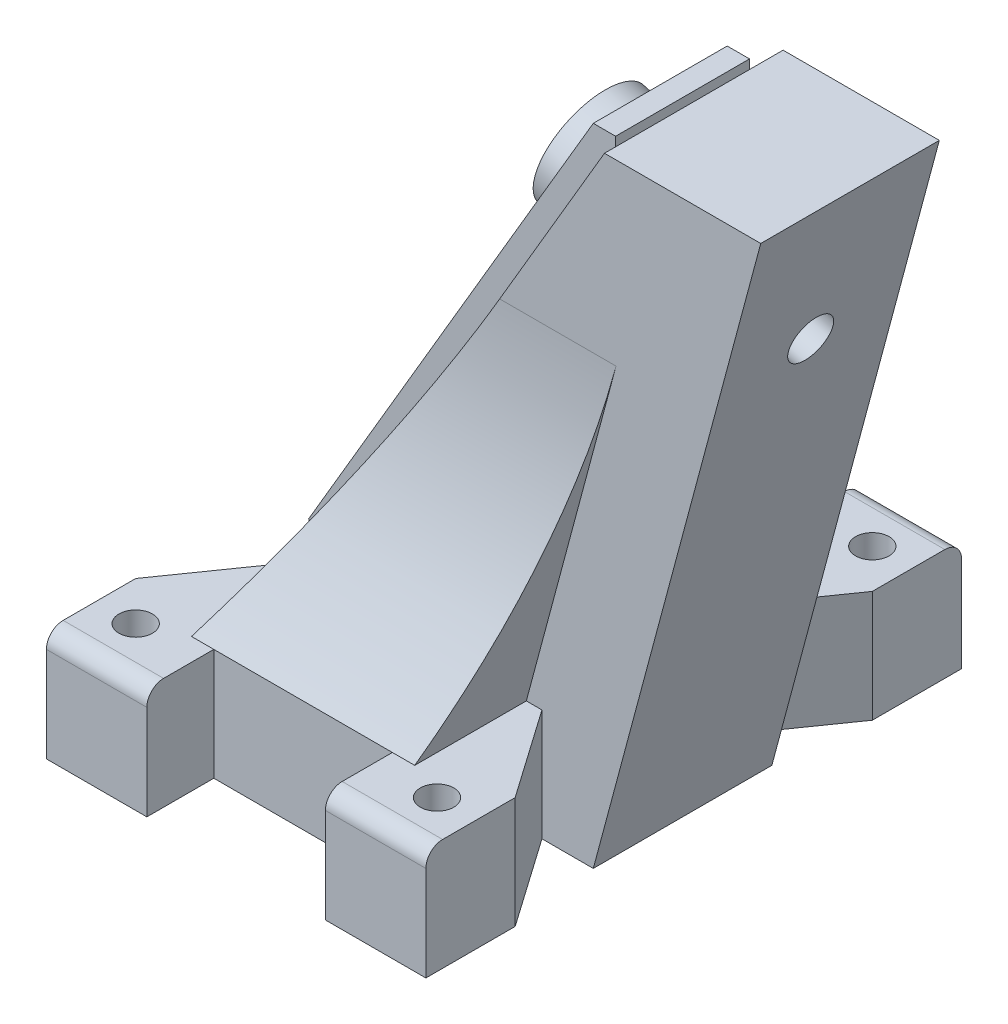
from build123d import *

# Parameters (mm, degrees)
BOSS_EXTRUDE1_DEPTH = 36
CUT_EXTRUDE1_REACH  = 77.774
SKETCH5_W           = 10
SKETCH5_H           = 10
CUT_EXTRUDE4_DEPTH  = 70.808427336
SKETCH6_W           = 10
SKETCH6_H           = 49.869122111
CUT_EXTRUDE5_DEPTH  = 8.383745
SKETCH7_R           = 1.5
BOSS_EXTRUDE2_DEPTH = 10
BOSS_EXTRUDE3_DEPTH = 6
SKETCH9_R           = 5
BOSS_EXTRUDE4_DEPTH = 20.4
CUT_EXTRUDE7_REACH  = 76.44
SKETCH12_R          = 2
FILLET1_R           = 1.5


with BuildPart() as part:
    # Sketch1 → Boss-Extrude1 (new body)
    with BuildSketch(Plane.XY):
        Polygon((0, 0), (-26, 0), (-26, 10), (1.005154776, 56), (15.005154776, 56), align=None)
    extrude(amount=BOSS_EXTRUDE1_DEPTH)

    # Sketch2 → Cut-Extrude1 (cut, up to next)
    with BuildSketch(Plane(origin=(-26, 3.422964937, 0), x_dir=(0, 0, -1), z_dir=(1, 0, 0)), mode=Mode.PRIVATE) as cut_extrude1_sk1:
        with BuildLine():
            Line((-26, 36.577035063), (-26, 52.577035063))
            Line((-26, 52.577035063), (-36, 52.577035063))
            Line((-36, 52.577035063), (-36, 6.577035063))
            ThreePointArc((-36, 6.577035063), (-28.565835097, 20.765646762), (-26, 36.577035063))
        make_face()
    cut_extrude1_tool1 = extrude(cut_extrude1_sk1.sketch, amount=CUT_EXTRUDE1_REACH, mode=Mode.PRIVATE) & part.part
    # Sketch2 → Cut-Extrude1 (cut, up to next)
    with BuildSketch(Plane(origin=(-26, 3.422964937, 0), x_dir=(0, 0, -1), z_dir=(1, 0, 0)), mode=Mode.PRIVATE) as cut_extrude1_sk2:
        with BuildLine():
            ThreePointArc((-10, 36.577035063), (-7.434164903, 20.765646762), (0, 6.577035063))
            Line((0, 6.577035063), (0, 52.577035063))
            Line((0, 52.577035063), (-10, 52.577035063))
            Line((-10, 52.577035063), (-10, 36.577035063))
        make_face()
    cut_extrude1_tool2 = extrude(cut_extrude1_sk2.sketch, amount=CUT_EXTRUDE1_REACH, mode=Mode.PRIVATE) & part.part
    # Sketch2 → Cut-Extrude1 (cut, up to next)
    with BuildSketch(Plane(origin=(-26, 3.422964937, 0), x_dir=(0, 0, -1), z_dir=(1, 0, 0)), mode=Mode.PRIVATE) as cut_extrude1_sk3:
        with BuildLine():
            ThreePointArc((-36, 6.577035063), (-28.565835097, 20.765646762), (-26, 36.577035063))
            Line((-26, 36.577035063), (-26, 52.577035063))
            Line((-26, 52.577035063), (-36, 52.577035063))
            Line((-36, 52.577035063), (-36, 6.577035063))
        make_face()
    cut_extrude1_tool3 = extrude(cut_extrude1_sk3.sketch, amount=CUT_EXTRUDE1_REACH, mode=Mode.PRIVATE) & part.part
    # Sketch2 → Cut-Extrude1 (cut, up to next)
    with BuildSketch(Plane(origin=(-26, 3.422964937, 0), x_dir=(0, 0, -1), z_dir=(1, 0, 0)), mode=Mode.PRIVATE) as cut_extrude1_sk4:
        with BuildLine():
            Line((0, 6.577035063), (0, 52.577035063))
            Line((0, 52.577035063), (-10, 52.577035063))
            Line((-10, 52.577035063), (-10, 36.577035063))
            ThreePointArc((-10, 36.577035063), (-7.434164903, 20.765646762), (0, 6.577035063))
        make_face()
    cut_extrude1_tool4 = extrude(cut_extrude1_sk4.sketch, amount=CUT_EXTRUDE1_REACH, mode=Mode.PRIVATE) & part.part
    add(cut_extrude1_tool1.solids().sort_by_distance((-26, 37.109216, 31.540478))[0], mode=Mode.SUBTRACT)
    add(cut_extrude1_tool2.solids().sort_by_distance((-26, 37.109216, 4.459522))[0], mode=Mode.SUBTRACT)
    add(cut_extrude1_tool3.solids().sort_by_distance((-26, 37.109216, 31.540478))[0], mode=Mode.SUBTRACT)
    add(cut_extrude1_tool4.solids().sort_by_distance((-26, 37.109216, 4.459522))[0], mode=Mode.SUBTRACT)

    # Sketch5 → Cut-Extrude4 (cut, through all)
    with BuildSketch(Plane.ZY.offset(6)):
        with Locations((31, 5)):
            Rectangle(SKETCH5_W, SKETCH5_H)
        with Locations((5, 5)):
            Rectangle(SKETCH5_W, SKETCH5_H)
    extrude(amount=-CUT_EXTRUDE4_DEPTH, mode=Mode.SUBTRACT)

    # Sketch6 → Cut-Extrude5 (cut)
    with BuildSketch(Plane(origin=(0, 0, 0), x_dir=(0, 0, -1), z_dir=(0.9659258262890674, -0.2588190451025246, 0))):
        with Locations((-31, 33.040905048)):
            Rectangle(SKETCH6_W, SKETCH6_H)
        with Locations((-5, 33.040905048)):
            Rectangle(SKETCH6_W, SKETCH6_H)
    extrude(amount=-CUT_EXTRUDE5_DEPTH, mode=Mode.SUBTRACT)

    # Sketch7 → Boss-Extrude2 (add)
    # profile 1 of 4: a face of its own
    with BuildSketch(Plane.XZ):
        Polygon((-26, 24), (-33, 34), (-33, 42), (-24, 42), (-24, 36), (-26, 36), align=None)
        with Locations(Location((-29.5, 37.5, 0), (0, 0, 270))):
            Circle(SKETCH7_R, mode=Mode.SUBTRACT)
    # profile 2 of 4: a face of its own
    with BuildSketch(Plane.XZ):
        Polygon((-26, 0), (-24, 0), (-24, -6), (-33, -6), (-33, 2), (-26, 12), align=None)
        with Locations(Location((-29.5, -1.5, 0), (0, 0, 90))):
            Circle(SKETCH7_R, mode=Mode.SUBTRACT)
    # profile 3 of 4: a face of its own
    with BuildSketch(Plane.XZ):
        Polygon((-6, 12), (1, 2), (1, -6), (-8, -6), (-8, 0), (-6, 0), align=None)
        with Locations(Location((-2.5, -1.5, 0), (0, 0, 270))):
            Circle(SKETCH7_R, mode=Mode.SUBTRACT)
    # profile 4 of 4: a face of its own
    with BuildSketch(Plane.XZ):
        Polygon((-6, 36), (-8, 36), (-8, 42), (1, 42), (1, 34), (-6, 24), align=None)
        with Locations(Location((-2.5, 37.5, 0), (0, 0, 90))):
            Circle(SKETCH7_R, mode=Mode.SUBTRACT)
    extrude(amount=-BOSS_EXTRUDE2_DEPTH)

    # Sketch8 → Boss-Extrude3 (add, symmetric)
    with BuildSketch(Plane.XY.offset(18)):
        Polygon((-26, 5), (-26, 10), (0, 54.287840966), (0, 55.819136666), (-2, 55.819136666), (-27.5, 12.382984949), align=None)
    extrude(amount=BOSS_EXTRUDE3_DEPTH, both=True)

    # Sketch9 → Boss-Extrude4 (add)
    with BuildSketch(Plane(origin=(0, 0, 0), x_dir=(0, 0, -1), z_dir=(-0.9659258262890674, 0.2588190451025246, 0))):
        with Locations(Location((-18, -44.351999472, 0), (0, 0, 270))):
            Circle(SKETCH9_R)
    extrude(amount=BOSS_EXTRUDE4_DEPTH)

    # Sketch12 → Cut-Extrude7 (cut, up to next)
    with BuildSketch(Plane(origin=(-19.704886856, 5.27990852, 0), x_dir=(0, 0, 1), z_dir=(-0.9659258262890673, 0.2588190451025247, 0)), mode=Mode.PRIVATE) as cut_extrude7_sk1:
        with Locations(Location((18, 44.351999472, 0), (0, 0, 270))):
            Circle(SKETCH12_R)
    cut_extrude7_tool1 = extrude(cut_extrude7_sk1.sketch, amount=-CUT_EXTRUDE7_REACH, mode=Mode.PRIVATE) & part.part
    add(cut_extrude7_tool1.solids().sort_by_distance((-8.225745, 48.12065, 18))[0], mode=Mode.SUBTRACT)

    # Fillet1
    fillet1_edges = [part.edges().sort_by_distance(p)[0] for p in [
        (-28.5, 10, 42),
        (-28.5, 10, -6),
        (-3.5, 10, -6),
        (-3.5, 10, 42),
    ]]
    fillet(fillet1_edges, radius=FILLET1_R)


solid = part.part
